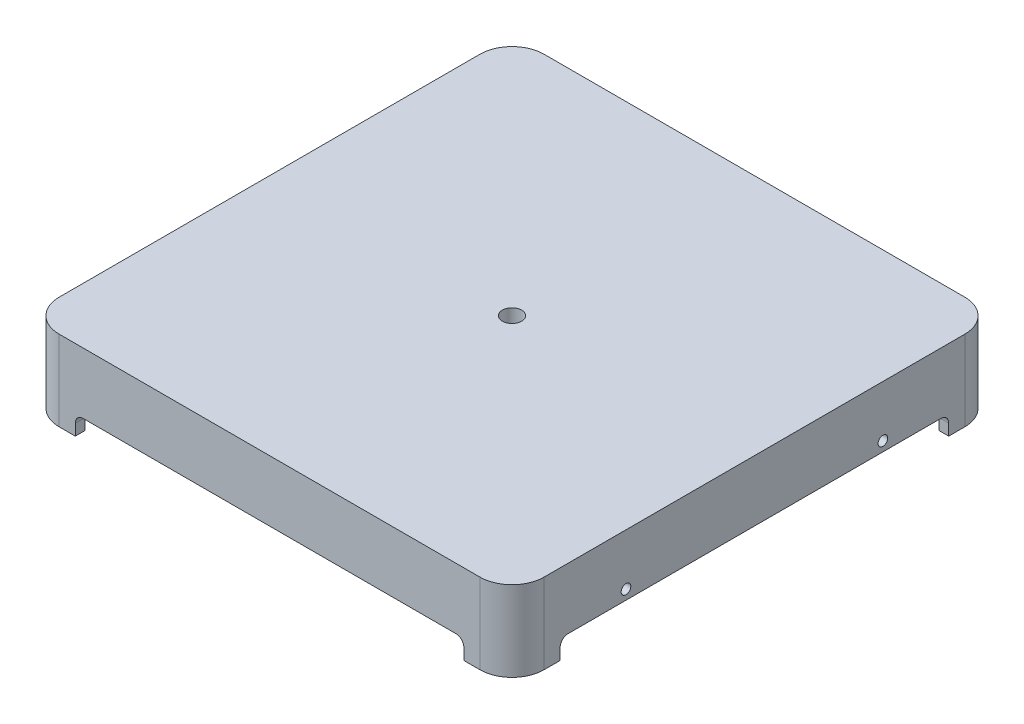
from build123d import *

# Parameters (mm, degrees)
SKETCH1_W           = 151
SKETCH1_H           = 151
BOSS_EXTRUDE1_DEPTH = 25
SKETCH2_W           = 145
SKETCH2_H           = 145
CUT_EXTRUDE1_DEPTH  = 12
SKETCH3_W           = 121
SKETCH3_H           = 6
CUT_EXTRUDE2_DEPTH  = 171.664143862
SKETCH4_W           = 121
SKETCH4_H           = 6
CUT_EXTRUDE3_DEPTH  = 171.664143862
FILLET1_R           = 10
SKETCH5_R           = 3
CUT_EXTRUDE4_DEPTH  = 110.660840777
FILLET4_R           = 2.5
SKETCH6_R           = 1.5
CUT_EXTRUDE5_DEPTH  = 171.664143862


with BuildPart() as part:
    # Sketch1 → Boss-Extrude1 (new body)
    with BuildSketch(Plane(origin=(0, 0, 0), x_dir=(1, 0, 0), z_dir=(0, 1, 0))):
        Rectangle(SKETCH1_W, SKETCH1_H)
    extrude(amount=BOSS_EXTRUDE1_DEPTH)

    # Sketch2 → Cut-Extrude1 (cut)
    with BuildSketch(Plane.XZ):
        Rectangle(SKETCH2_W, SKETCH2_H)
    extrude(amount=-CUT_EXTRUDE1_DEPTH, mode=Mode.SUBTRACT)

    # Sketch3 → Cut-Extrude2 (cut, through all)
    with BuildSketch(Plane.XY.offset(75.5)):
        with Locations((0, 3)):
            Rectangle(SKETCH3_W, SKETCH3_H)
    extrude(amount=-CUT_EXTRUDE2_DEPTH, mode=Mode.SUBTRACT)

    # Sketch4 → Cut-Extrude3 (cut, through all)
    with BuildSketch(Plane.ZY.offset(75.5)):
        with Locations((0, 3)):
            Rectangle(SKETCH4_W, SKETCH4_H)
    extrude(amount=-CUT_EXTRUDE3_DEPTH, mode=Mode.SUBTRACT)

    # Fillet1
    fillet1_edges = [part.edges().sort_by_distance(p)[0] for p in [
        (72.5, 6, 72.5),
        (72.5, 6, -72.5),
        (-72.5, 6, -72.5),
        (-72.5, 6, 72.5),
        (75.5, 12.5, 75.5),
        (-75.5, 12.5, 75.5),
        (-75.5, 12.5, -75.5),
        (75.5, 12.5, -75.5),
    ]]
    fillet(fillet1_edges, radius=FILLET1_R)

    # Sketch5 → Cut-Extrude4 (cut, through all)
    with BuildSketch(Plane(origin=(0, 25, 0), x_dir=(1, 0, 0), z_dir=(0, 1, 0))):
        with Locations(Location((0, 0, 0), (0, 0, 270))):
            Circle(SKETCH5_R)
    extrude(amount=-CUT_EXTRUDE4_DEPTH, mode=Mode.SUBTRACT)

    # Fillet4
    fillet4_edges = [part.edges().sort_by_distance(p)[0] for p in [
        (-60.5, 6, -74),
        (-60.5, 6, 74),
        (60.5, 6, -74),
        (60.5, 6, 74),
        (74, 6, -60.5),
        (-74, 6, -60.5),
        (74, 6, 60.5),
        (-74, 6, 60.5),
    ]]
    fillet(fillet4_edges, radius=FILLET4_R)

    # Sketch6 → Cut-Extrude5 (cut, through all)
    with BuildSketch(Plane(origin=(-75.5, 0, 0), x_dir=(0, 0, -1), z_dir=(1, 0, 0))):
        with Locations(Location((-40, 9, 0), (0, 0, 180))):
            Circle(SKETCH6_R)
        with Locations(Location((40, 9, 0), (0, 0, 180))):
            Circle(SKETCH6_R)
    extrude(amount=CUT_EXTRUDE5_DEPTH, mode=Mode.SUBTRACT)


solid = part.part
